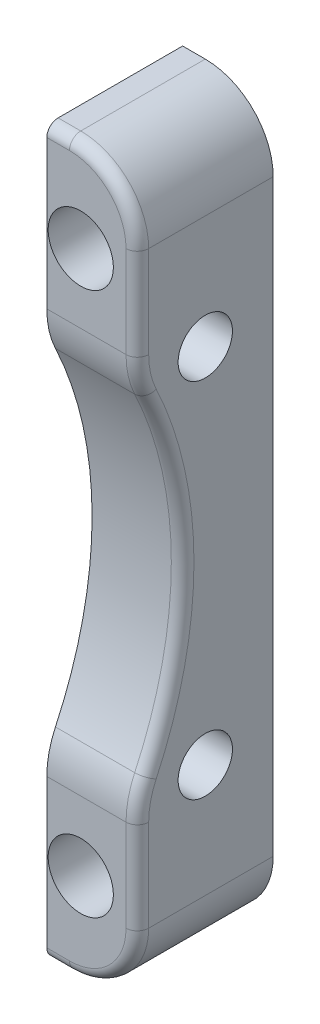
from build123d import *

# Parameters (mm, degrees)
BOSS_EXTRUDE1_DEPTH = 6.35
CUT_EXTRUDE1_REACH  = 29.861
SKETCH2_R           = 2.286
CUT_EXTRUDE2_REACH  = 29.861
SKETCH3_R           = 1.905
FILLET1_R           = 4.7625
FILLET2_R           = 6.35
FILLET3_R           = 0.79375


with BuildPart() as part:
    # Sketch1 → Boss-Extrude1 (new body)
    with BuildSketch(Plane(origin=(0, 0, 0), x_dir=(0, 0, -1), z_dir=(1, 0, 0))):
        with BuildLine():
            Line((0, -25.4), (0, 25.4))
            Line((0, 25.4), (-9.525, 25.4))
            Line((-9.525, 25.4), (-9.525, 12.7))
            ThreePointArc((-9.525, 12.7), (-6.35, 0), (-9.525, -12.7))
            Line((-9.525, -12.7), (-9.525, -25.4))
            Line((-9.525, -25.4), (0, -25.4))
        make_face()
    extrude(amount=BOSS_EXTRUDE1_DEPTH)

    # Sketch2 → Cut-Extrude1 (cut, up to next)
    with BuildSketch(Plane.XY.offset(9.525), mode=Mode.PRIVATE) as cut_extrude1_sk1:
        with Locations((2.38125, 19.05)):
            Circle(SKETCH2_R)
    cut_extrude1_tool1 = extrude(cut_extrude1_sk1.sketch, amount=-CUT_EXTRUDE1_REACH, mode=Mode.PRIVATE) & part.part
    # Sketch2 → Cut-Extrude1 (cut, up to next)
    with BuildSketch(Plane.XY.offset(9.525), mode=Mode.PRIVATE) as cut_extrude1_sk2:
        with Locations((2.38125, -19.05)):
            Circle(SKETCH2_R)
    cut_extrude1_tool2 = extrude(cut_extrude1_sk2.sketch, amount=-CUT_EXTRUDE1_REACH, mode=Mode.PRIVATE) & part.part
    add(cut_extrude1_tool1.solids().sort_by_distance((2.38125, 19.05, 9.525))[0], mode=Mode.SUBTRACT)
    add(cut_extrude1_tool2.solids().sort_by_distance((2.38125, -19.05, 9.525))[0], mode=Mode.SUBTRACT)

    # Sketch3 → Cut-Extrude2 (cut, up to next)
    with BuildSketch(Plane(origin=(6.35, 0, 0), x_dir=(0, 0, -1), z_dir=(1, 0, 0)), mode=Mode.PRIVATE) as cut_extrude2_sk1:
        with Locations((-4.7625, 12.7)):
            Circle(SKETCH3_R)
    cut_extrude2_tool1 = extrude(cut_extrude2_sk1.sketch, amount=-CUT_EXTRUDE2_REACH, mode=Mode.PRIVATE) & part.part
    # Sketch3 → Cut-Extrude2 (cut, up to next)
    with BuildSketch(Plane(origin=(6.35, 0, 0), x_dir=(0, 0, -1), z_dir=(1, 0, 0)), mode=Mode.PRIVATE) as cut_extrude2_sk2:
        with Locations((-4.7625, -12.7)):
            Circle(SKETCH3_R)
    cut_extrude2_tool2 = extrude(cut_extrude2_sk2.sketch, amount=-CUT_EXTRUDE2_REACH, mode=Mode.PRIVATE) & part.part
    add(cut_extrude2_tool1.solids().sort_by_distance((6.35, 12.7, 4.7625))[0], mode=Mode.SUBTRACT)
    add(cut_extrude2_tool2.solids().sort_by_distance((6.35, -12.7, 4.7625))[0], mode=Mode.SUBTRACT)

    # Fillet1
    fillet1_edges = [part.edges().sort_by_distance(p)[0] for p in [
        (6.35, 25.4, 4.7625),
        (6.35, -25.4, 4.7625),
    ]]
    fillet(fillet1_edges, radius=FILLET1_R)

    # Fillet2
    fillet2_edges = [part.edges().sort_by_distance(p)[0] for p in [
        (3.175, -12.7, 9.525),
        (3.175, 12.7, 9.525),
    ]]
    fillet(fillet2_edges, radius=FILLET2_R)

    # Fillet3
    fillet3_edges = [part.edges().sort_by_distance(p)[0] for p in [
        (6.35, 17.418265829, 9.525),
        (0.79375, -25.4, 9.525),
        (4.955096045, -24.005096045, 9.525),
        (0.79375, 25.4, 9.525),
        (4.955096045, 24.005096045, 9.525),
        (6.35, -17.418265829, 9.525),
        (6.35, 0, 6.35),
        (6.35, 12.813348054, 9.371965463),
        (6.35, -12.813348054, 9.371965463),
    ]]
    fillet(fillet3_edges, radius=FILLET3_R)


solid = part.part
